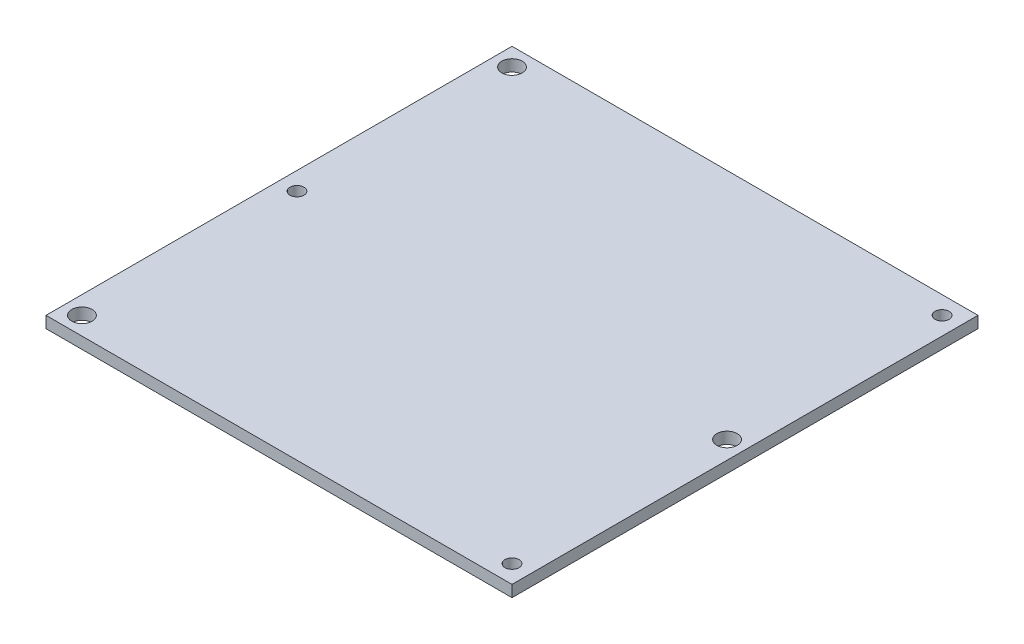
from build123d import *

# Parameters (mm, degrees)
SKETCH1_W           = 342.9
SKETCH1_H           = 342.9
BOSS_EXTRUDE1_DEPTH = 8.5
SKETCH2_R           = 4
CUT_EXTRUDE1_DEPTH  = 243.615858921
SKETCH3_R           = 7.5
SKETCH3_R_2         = 5.15
CUT_EXTRUDE3_DEPTH  = 10


with BuildPart() as part:
    # Sketch1 → Boss-Extrude1 (new body)
    with BuildSketch(Plane(origin=(0, 0, 0), x_dir=(1, 0, 0), z_dir=(0, 1, 0))):
        Rectangle(SKETCH1_W, SKETCH1_H)
    extrude(amount=BOSS_EXTRUDE1_DEPTH)

    # Sketch2 → Cut-Extrude1 (cut, through all)
    with BuildSketch(Plane(origin=(0, 8.5, 0), x_dir=(1, 0, 0), z_dir=(0, 1, 0))):
        with Locations(Location((-158.225, 158.225, 0), (0, 0, 270))):
            Circle(SKETCH2_R)
        with Locations(Location((-158.225, 0, 0), (0, 0, 270))):
            Circle(SKETCH2_R)
        with Locations(Location((-158.225, -158.225, 0), (0, 0, 270))):
            Circle(SKETCH2_R)
        with Locations(Location((158.225, 158.225, 0), (0, 0, 270))):
            Circle(SKETCH2_R)
        with Locations(Location((158.225, 0, 0), (0, 0, 270))):
            Circle(SKETCH2_R)
        with Locations(Location((158.225, -158.225, 0), (0, 0, 270))):
            Circle(SKETCH2_R)
    extrude(amount=-CUT_EXTRUDE1_DEPTH, mode=Mode.SUBTRACT)

    # Sketch3 → Cut-Extrude3 (cut)
    with BuildSketch(Plane(origin=(0, 8.5, 0), x_dir=(1, 0, 0), z_dir=(0, 1, 0))):
        with Locations(Location((-158.225, 158.225, 0), (0, 0, 270))):
            Circle(SKETCH3_R)
        with Locations(Location((-158.225, -158.225, 0), (0, 0, 270))):
            Circle(SKETCH3_R)
        with Locations(Location((-158.225, 0, 0), (0, 0, 270))):
            Circle(SKETCH3_R_2)
        with Locations(Location((158.225, 0, 0), (0, 0, 270))):
            Circle(SKETCH3_R)
        with Locations(Location((158.225, 158.225, 0), (0, 0, 270))):
            Circle(SKETCH3_R_2)
        with Locations(Location((158.225, -158.225, 0), (0, 0, 270))):
            Circle(SKETCH3_R_2)
    extrude(amount=-CUT_EXTRUDE3_DEPTH, mode=Mode.SUBTRACT)


solid = part.part
